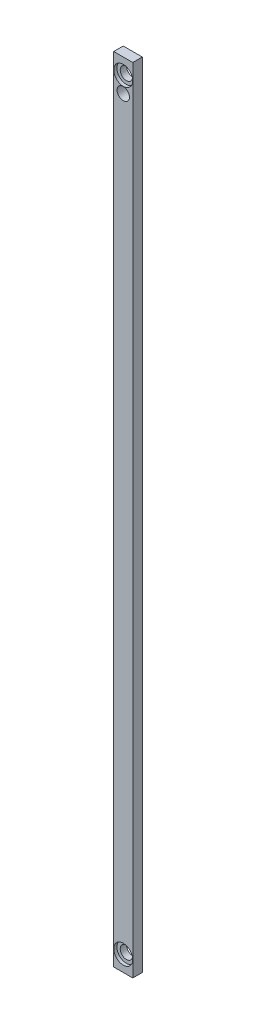
from build123d import *

# Parameters (mm, degrees)
ESQUISSE1_W             = 6
ESQUISSE1_H             = 250
BOSS_EXTRU_1_DEPTH      = 3
ESQUISSE2_R             = 1.95
ENL_V_MAT_EXTRU_1_DEPTH = 3
ESQUISSE3_R             = 2.995
ENL_V_MAT_EXTRU_3_DEPTH = 1


with BuildPart() as part:
    # Esquisse1 → Boss.-Extru.1 (new body)
    with BuildSketch(Plane.XY):
        with Locations((-3, 125)):
            Rectangle(ESQUISSE1_W, ESQUISSE1_H)
    extrude(amount=BOSS_EXTRU_1_DEPTH)

    # Esquisse2 → Enlèv. mat.-Extru.1 (cut)
    with BuildSketch(Plane.XY.offset(3)):
        with Locations((-3, 245)):
            Circle(ESQUISSE2_R)
        with Locations((-3, 240)):
            Circle(ESQUISSE2_R)
        with Locations((-3, 5)):
            Circle(ESQUISSE2_R)
    extrude(amount=-ENL_V_MAT_EXTRU_1_DEPTH, mode=Mode.SUBTRACT)

    # Esquisse3 → Enlèv. mat.-Extru.3 (cut)
    with BuildSketch(Plane.XY.offset(3)):
        with Locations((-3, 5)):
            Circle(ESQUISSE3_R)
        with Locations((-3, 245)):
            Circle(ESQUISSE3_R)
    extrude(amount=-ENL_V_MAT_EXTRU_3_DEPTH, mode=Mode.SUBTRACT)


solid = part.part
